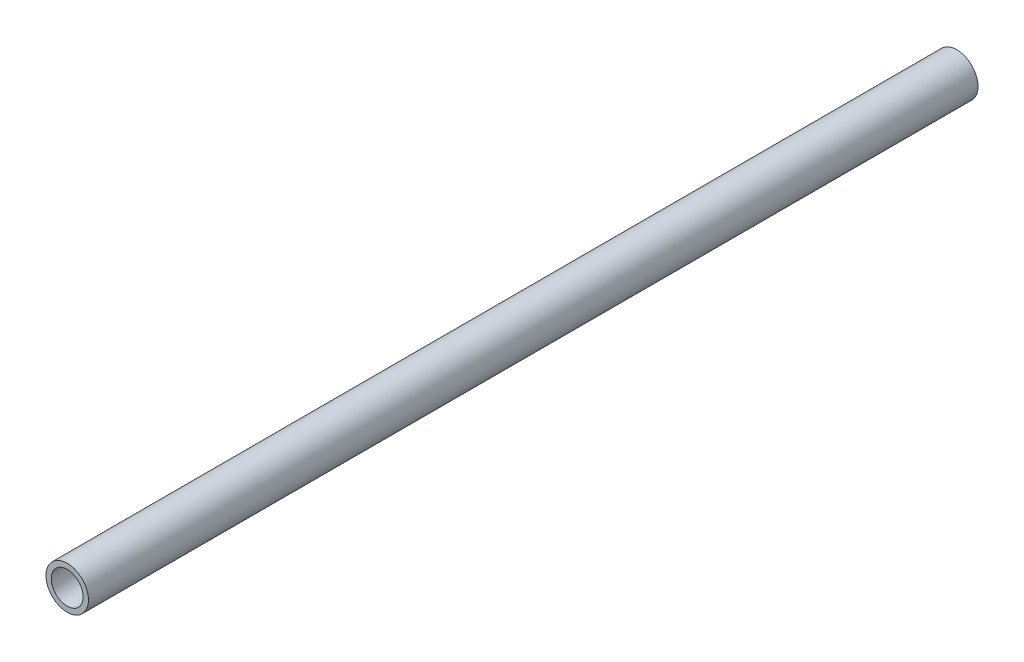
from build123d import *

# Parameters (mm, degrees)
SKETCH1_R           = 8
SKETCH1_R_2         = 6
BOSS_EXTRUDE1_DEPTH = 335


with BuildPart() as part:
    # Sketch1 → Boss-Extrude1 (new body)
    with BuildSketch(Plane.XY):
        Circle(SKETCH1_R)
        Circle(SKETCH1_R_2, mode=Mode.SUBTRACT)
    extrude(amount=BOSS_EXTRUDE1_DEPTH)


solid = part.part
